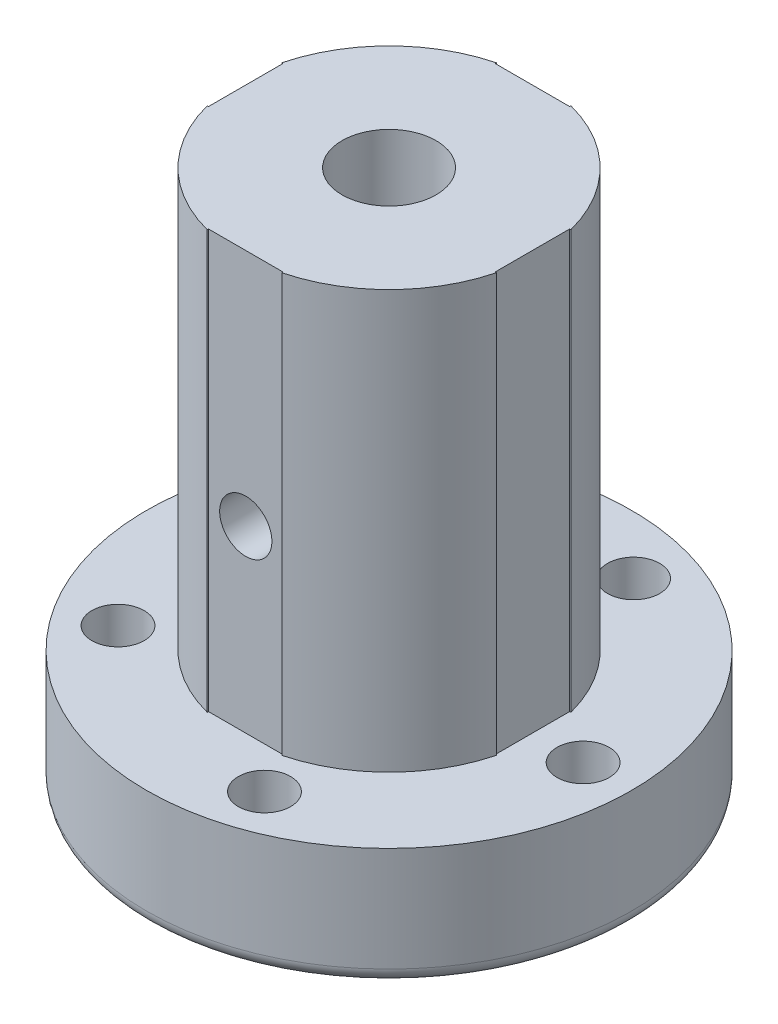
from build123d import *

# Parameters (mm, degrees)
SKETCH1_R           = 16.25
BOSS_EXTRUDE1_DEPTH = 8
SKETCH2_R           = 10
BOSS_EXTRUDE2_DEPTH = 28
SKETCH3_R           = 3.15
CUT_EXTRUDE1_DEPTH  = 25
SKETCH4_W           = 1.193492023
SKETCH4_H           = 5
CUT_EXTRUDE2_DEPTH  = 28
CIRPATTERN1_COUNT   = 4
SKETCH5_R           = 1.75
CUT_EXTRUDE3_DEPTH  = 25
FILLET1_R           = 1
SKETCH6_R           = 1.75
CUT_EXTRUDE4_DEPTH  = 25
SKETCH7_R           = 1.75
CUT_EXTRUDE5_DEPTH  = 10
CIRPATTERN2_COUNT   = 5


with BuildPart() as part:
    # Sketch1 → Boss-Extrude1 (new body)
    with BuildSketch(Plane(origin=(0, 0, 0), x_dir=(1, 0, 0), z_dir=(0, 1, 0))):
        with Locations(Location((0, 0, 0), (0, 0, 270))):
            Circle(SKETCH1_R)
    extrude(amount=BOSS_EXTRUDE1_DEPTH)

    # Sketch2 → Boss-Extrude2 (add)
    with BuildSketch(Plane(origin=(0, 8, 0), x_dir=(1, 0, 0), z_dir=(0, 1, 0))):
        with Locations(Location((0, 0, 0), (0, 0, 270))):
            Circle(SKETCH2_R)
    extrude(amount=BOSS_EXTRUDE2_DEPTH)

    # Sketch3 → Cut-Extrude1 (cut)
    with BuildSketch(Plane(origin=(0, 36, 0), x_dir=(1, 0, 0), z_dir=(0, 1, 0))):
        with Locations(Location((0, 0, 0), (0, 0, 270))):
            Circle(SKETCH3_R)
    extrude(amount=-CUT_EXTRUDE1_DEPTH, mode=Mode.SUBTRACT)

    # Sketch4 → Cut-Extrude2 (cut)
    with BuildSketch(Plane(origin=(0, 36, 0), x_dir=(1, 0, 0), z_dir=(0, 1, 0))):
        with Locations((10.196746012, 0)):
            Rectangle(SKETCH4_W, SKETCH4_H)
    cut_extrude2 = extrude(amount=-CUT_EXTRUDE2_DEPTH, mode=Mode.SUBTRACT)

    # CirPattern1: Cut-Extrude2 ×4 about axis
    cirpattern1_axis = Axis((0, 0, 0), (0, 1, 0))
    for i in range(1, CIRPATTERN1_COUNT):
        add(cut_extrude2.rotate(cirpattern1_axis, i * 360 / CIRPATTERN1_COUNT), mode=Mode.SUBTRACT)

    # Sketch5 → Cut-Extrude3 (cut)
    with BuildSketch(Plane(origin=(0, 0, -9.6), x_dir=(-1, 0, 0), z_dir=(0, 0, -1))):
        with Locations((0, 20)):
            Circle(SKETCH5_R)
    extrude(amount=-CUT_EXTRUDE3_DEPTH, mode=Mode.SUBTRACT)

    # Fillet1
    fillet1_edges = [part.edges().sort_by_distance(p)[0] for p in [
        (0, 0, -16.25),
    ]]
    fillet(fillet1_edges, radius=FILLET1_R)

    # Sketch6 → Cut-Extrude4 (cut)
    with BuildSketch(Plane(origin=(0, 0, 0), x_dir=(-1, 0, 0), z_dir=(0, -1, 0))):
        with Locations(Location((0, 0, 0), (0, 0, 90))):
            Circle(SKETCH6_R)
    extrude(amount=-CUT_EXTRUDE4_DEPTH, mode=Mode.SUBTRACT)

    # Sketch7 → Cut-Extrude5 (cut)
    with BuildSketch(Plane(origin=(0, 0, 0), x_dir=(-1, 0, 0), z_dir=(0, -1, 0))):
        with Locations(Location((-13, 0, 0), (0, 0, 90))):
            Circle(SKETCH7_R)
    cut_extrude5 = extrude(amount=-CUT_EXTRUDE5_DEPTH, mode=Mode.SUBTRACT)

    # CirPattern2: Cut-Extrude5 ×5 about axis
    cirpattern2_axis = Axis((0, 0, 0), (0, 1, 0))
    for i in range(1, CIRPATTERN2_COUNT):
        add(cut_extrude5.rotate(cirpattern2_axis, i * 360 / CIRPATTERN2_COUNT), mode=Mode.SUBTRACT)


solid = part.part
